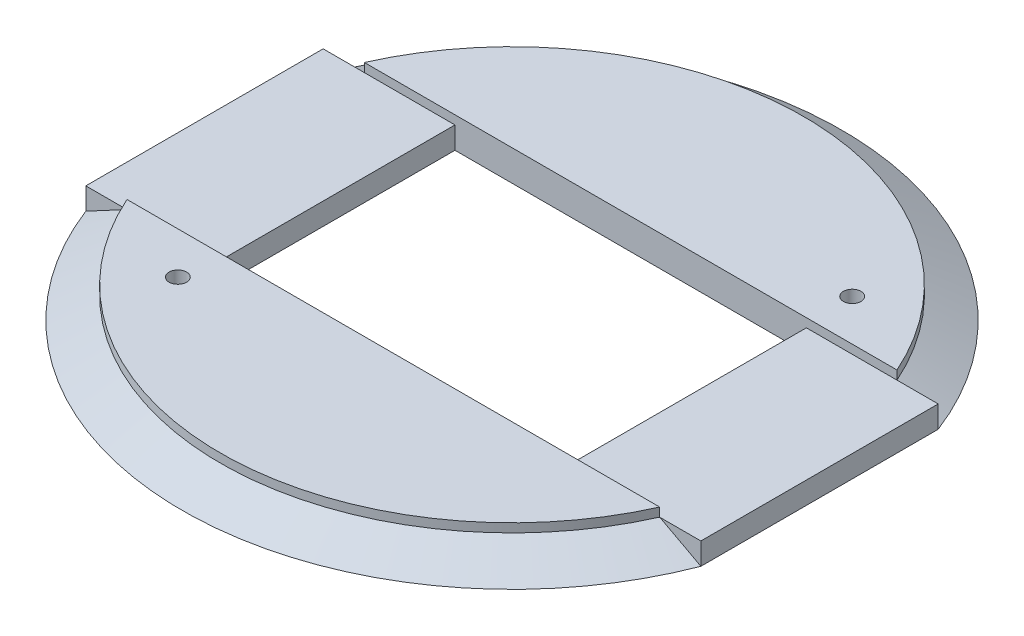
from build123d import *

# Parameters (mm, degrees)
SKETCH7_R           = 33.17091481
BOSS_EXTRUDE2_DEPTH = 1
SKETCH13_W          = 75
SKETCH13_H          = 27
CUT_EXTRUDE2_DEPTH  = 54.148377209
SKETCH18_W          = 14.996875164
SKETCH18_H          = 27
BOSS_EXTRUDE4_DEPTH = 2.5
SKETCH18_3_W        = 14.996875164
SKETCH18_3_H        = 27
SKETCH18_3_W_2      = 14.998441489
BOSS_EXTRUDE5_DEPTH = 2.5
SKETCH20_R          = 0.999251596
SKETCH20_R_2        = 1.000371823
CUT_EXTRUDE3_DEPTH  = 52.40525265


with BuildPart() as part:
    # Sketch3 → Revolve1 (revolve)
    with BuildSketch(Plane.XY):
        Polygon((0, 0), (37.5, 0), (33.17091481, 2.5), (0, 2.5), align=None)
    revolve(axis=Axis((0, 0, 0), (0, 1, 0)))

    # Sketch7 → Boss-Extrude2 (add)
    with BuildSketch(Plane(origin=(0, 2.5, 0), x_dir=(1, 0, 0), z_dir=(0, 1, 0))):
        Circle(SKETCH7_R)
    extrude(amount=BOSS_EXTRUDE2_DEPTH)

    # Sketch13 → Cut-Extrude2 (cut, through all)
    with BuildSketch(Plane.XZ):
        Rectangle(SKETCH13_W, SKETCH13_H)
    extrude(amount=-CUT_EXTRUDE2_DEPTH, mode=Mode.SUBTRACT)


with BuildPart() as cut_extrude2_piece_1:
    # of the separate pieces the step leaves, piece 1, a body of its own (cut_extrude2_pieces)
    add(part.part.solids().sort_by_distance((-34.985711369, 0, 13.5))[0])



with BuildPart() as cut_extrude2_piece_2:
    # of the separate pieces the step leaves, piece 2, a body of its own (cut_extrude2_pieces)
    add(part.part.solids().sort_by_distance((34.985711369, 0, -13.5))[0])


with BuildPart() as cut_extrude2_piece_1_1:
    add(cut_extrude2_piece_1.part)

    add(cut_extrude2_piece_2.part)  # Boss-Extrude4 merges Cut-Extrude2 piece 2
    # Sketch18 → Boss-Extrude4 (add)
    with BuildSketch(Plane(origin=(0, 0, 0), x_dir=(1, 0, 0), z_dir=(0, 1, 0))):
        with Locations((27.487273787, 0)):
            Rectangle(SKETCH18_W, SKETCH18_H)
    extrude(amount=BOSS_EXTRUDE4_DEPTH)

    # Sketch18<3> → Boss-Extrude5 (add)
    with BuildSketch(Plane(origin=(0, 0, 0), x_dir=(1, 0, 0), z_dir=(0, 1, 0))):
        with Locations((27.487273787, 0)):
            Rectangle(SKETCH18_3_W, SKETCH18_3_H)
        with Locations((-27.486490625, 0)):
            Rectangle(SKETCH18_3_W_2, SKETCH18_3_H)
    extrude(amount=BOSS_EXTRUDE5_DEPTH)

    # Sketch20 → Cut-Extrude3 (cut, through all)
    with BuildSketch(Plane(origin=(0, 3.5, 0), x_dir=(1, 0, 0), z_dir=(0, 1, 0))):
        with Locations((-19.757076847, -18.256562674)):
            Circle(SKETCH20_R)
        with Locations((20.497529554, 18.200406752)):
            Circle(SKETCH20_R_2)
    extrude(amount=-CUT_EXTRUDE3_DEPTH, mode=Mode.SUBTRACT)


solid = cut_extrude2_piece_1_1.part
